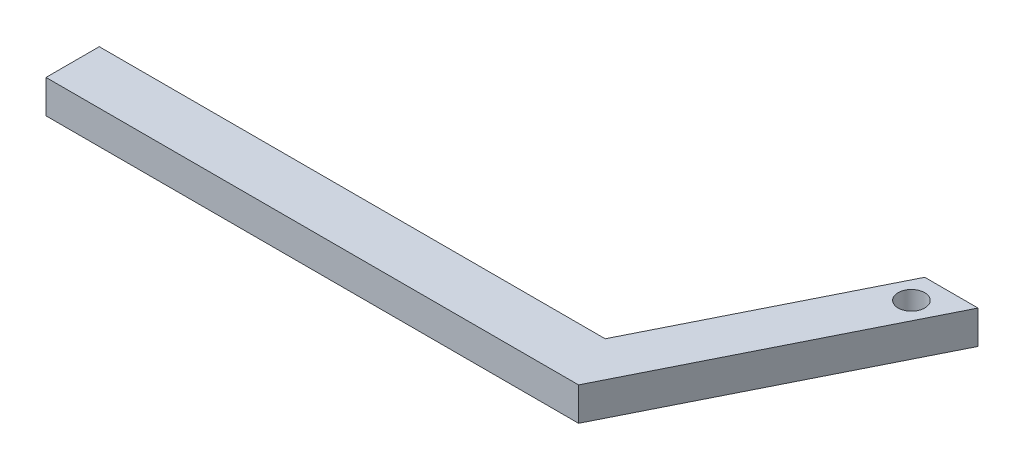
from build123d import *

# Parameters (mm, degrees)
SKETCH1_W           = 50.8
SKETCH1_H           = 3.175
BOSS_EXTRUDE1_DEPTH = 5.08
SKETCH2_R           = 1.27
BOSS_EXTRUDE2_DEPTH = 3.175


with BuildPart() as part:
    # Sketch1 → Boss-Extrude1 (new body)
    with BuildSketch(Plane.XY):
        Rectangle(SKETCH1_W, SKETCH1_H)
    extrude(amount=BOSS_EXTRUDE1_DEPTH)

    # Sketch2 → Boss-Extrude2 (add)
    with BuildSketch(Plane(origin=(0, -1.5875, 0), x_dir=(-1, 0, 0), z_dir=(0, -1, 0))):
        Polygon((-25.4, -5.08), (-38.1, 20.32), (-33.02, 20.32), (-20.32, -5.08), align=None)
        with Locations(Location((-34.29, 17.78, 0), (0, 0, 180))):
            Circle(SKETCH2_R, mode=Mode.SUBTRACT)
    extrude(amount=-BOSS_EXTRUDE2_DEPTH)


solid = part.part
